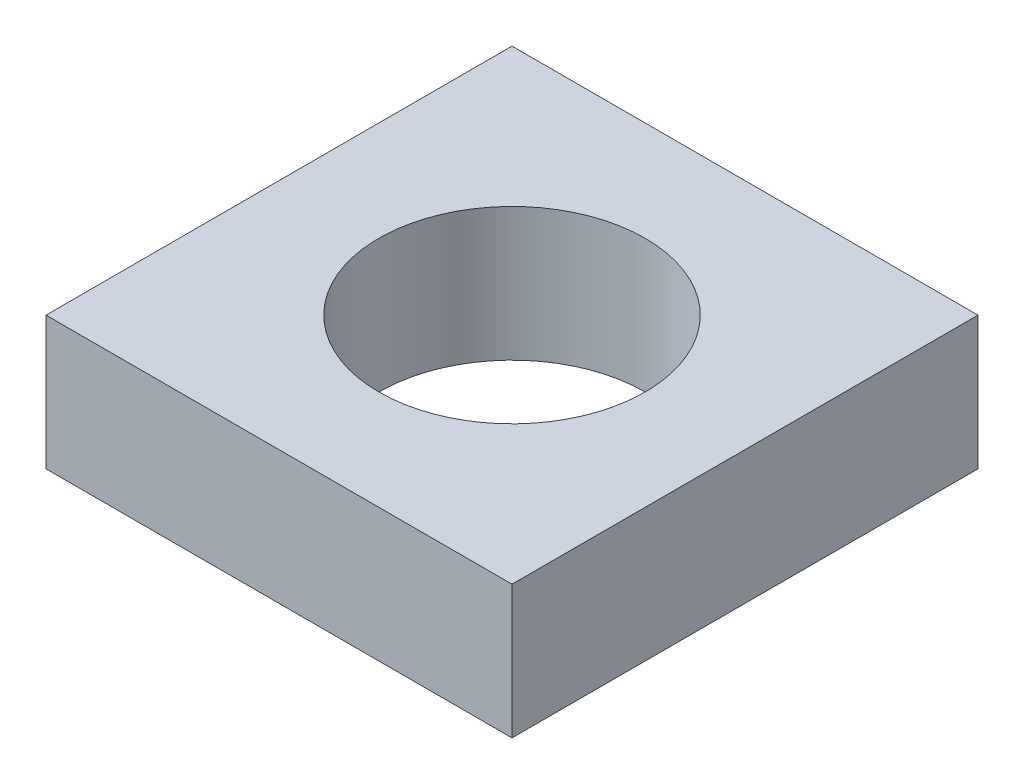
from build123d import *

# Parameters (mm, degrees)
SKETCH_1_W      = 7
SKETCH_1_H      = 7
SKETCH_1_R      = 2
EXTRUDE_1_DEPTH = 2


with BuildPart() as part:
    # 草图1 → 凸台-拉伸1 (new body)
    with BuildSketch(Plane(origin=(0, 0, 0), x_dir=(1, 0, 0), z_dir=(0, 1, 0))):
        Rectangle(SKETCH_1_W, SKETCH_1_H)
        with Locations(Location((0, 0, 0), (0, 0, 270))):
            Circle(SKETCH_1_R, mode=Mode.SUBTRACT)
    extrude(amount=EXTRUDE_1_DEPTH)


solid = part.part
